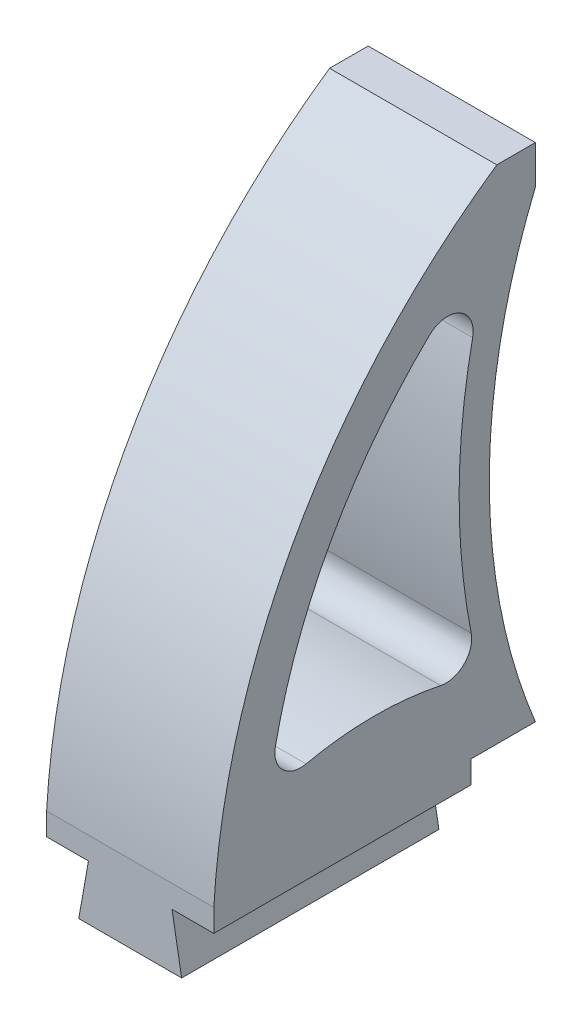
from build123d import *

# Parameters (mm, degrees)
BOSS_EXTRUDE2_DEPTH = 6.5
CUT_EXTRUDE1_DEPTH  = 47.778734485
CUT_EXTRUDE2_DEPTH  = 45.010875493


with BuildPart() as part:
    # Sketch2 → Boss-Extrude2 (new, symmetric)
    with BuildSketch(Plane(origin=(0, 0, 0), x_dir=(0, 0, -1), z_dir=(1, 0, 0))):
        with BuildLine():
            Line((-15.714870718, 0), (-15.714870718, -6))
            Line((-15.714870718, -6), (4.285129282, -6))
            Line((4.285129282, -6), (4.285129282, 0))
            Line((4.285129282, 0), (9.285129282, 0))
            ThreePointArc((9.285129282, 0), (5.701715974, 18), (9.285129282, 36))
            Line((9.285129282, 36), (9.285129282, 39))
            Line((9.285129282, 39), (6.285129282, 39))
            ThreePointArc((6.285129282, 39), (-9.226389961, 22.044959573), (-15.714870718, 0))
        make_face()
    extrude(amount=BOSS_EXTRUDE2_DEPTH, both=True)

    # Sketch3 → Cut-Extrude1 (cut, through all)
    with BuildSketch(Plane.XY.offset(15.714870718)):
        Polygon((6.5, -6), (6.5, -1.746538635), (3.25, -1.746538635), (4, -6), align=None)
        Polygon((-6.5, -6), (-4, -6), (-3.25, -1.746538635), (-6.5, -1.746538635), align=None)
    extrude(amount=-CUT_EXTRUDE1_DEPTH, mode=Mode.SUBTRACT)

    # Sketch4 → Cut-Extrude2 (cut, through all)
    with BuildSketch(Plane(origin=(6.5, 0, 0), x_dir=(0, 0, -1), z_dir=(1, 0, 0))):
        with BuildLine():
            ThreePointArc((4.293654014, 8.463820333), (3.356236623, 18.389014044), (4.406551478, 28.302896243))
            ThreePointArc((4.406551478, 28.302896243), (3.415993904, 30.4613018), (1.061425552, 30.151581393))
            ThreePointArc((1.061425552, 30.151581393), (-6.57340708, 20.201122888), (-10.929733391, 8.439970103))
            ThreePointArc((-10.929733391, 8.439970103), (-10.378680687, 6.611841621), (-8.545133867, 6.07909507))
            ThreePointArc((-8.545133867, 6.07909507), (-3.314593754, 6.65373917), (1.920364292, 6.120841452))
            ThreePointArc((1.920364292, 6.120841452), (3.736278671, 6.654920589), (4.293654014, 8.463820333))
        make_face()
    extrude(amount=-CUT_EXTRUDE2_DEPTH, mode=Mode.SUBTRACT)


solid = part.part
